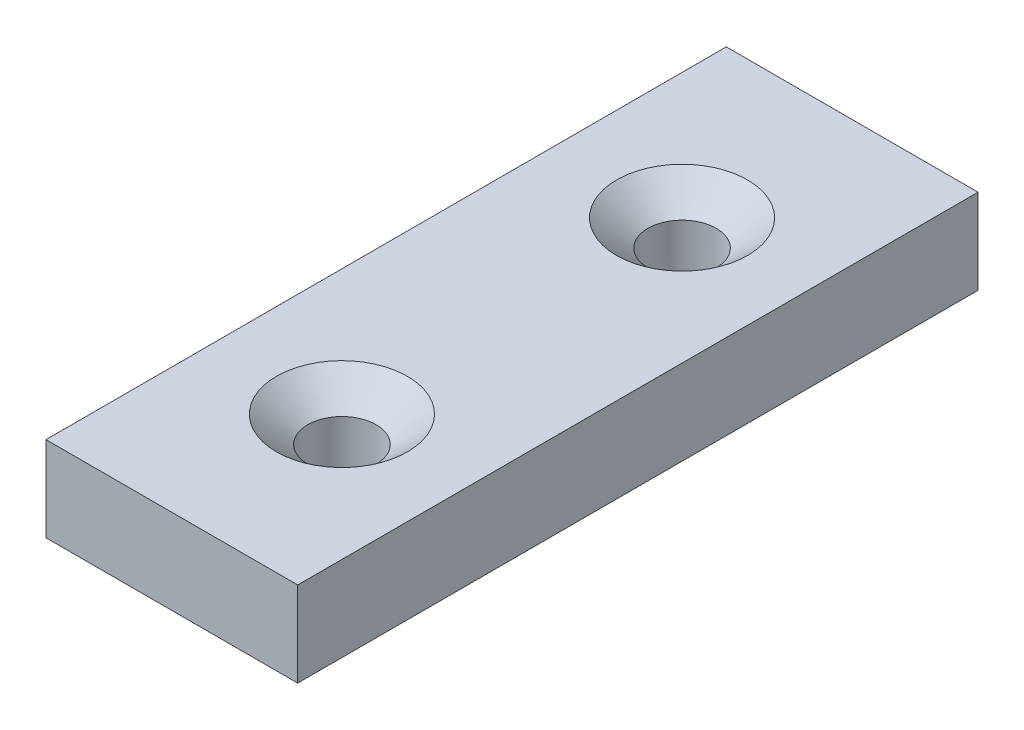
from build123d import *

# Parameters (mm, degrees)
SKETCH1_W                                          = 18.796
SKETCH1_H                                          = 50.8
BOSS_EXTRUDE1_DEPTH                                = 6.35
CSK_FOR_10_FLAT_HEAD_MACHINE_SCREW_100_D           = 5.1054
CSK_FOR_10_FLAT_HEAD_MACHINE_SCREW_100_DEPTH       = 25.4
CSK_FOR_10_FLAT_HEAD_MACHINE_SCREW_100_CSINK_D     = 9.779
CSK_FOR_10_FLAT_HEAD_MACHINE_SCREW_100_CSINK_ANGLE = 100
CSK_FOR_10_FLAT_HEAD_MACHINE_SCREW_100_TIP         = 1.533816902


with BuildPart() as part:
    # Sketch1 → Boss-Extrude1 (new body)
    with BuildSketch(Plane(origin=(0, 0, 0), x_dir=(1, 0, 0), z_dir=(0, 1, 0))):
        with Locations((9.398, 25.4)):
            Rectangle(SKETCH1_W, SKETCH1_H)
    extrude(amount=BOSS_EXTRUDE1_DEPTH)

    # CSK for #10 Flat Head Machine Screw (100)1
    with Locations(Plane(origin=(0, 6.35, 0), x_dir=(1, 0, 0), z_dir=(0, 1, 0))):
        with Locations((9.398, 38.1), (9.398, 12.7)):
            CounterSinkHole(CSK_FOR_10_FLAT_HEAD_MACHINE_SCREW_100_D / 2, CSK_FOR_10_FLAT_HEAD_MACHINE_SCREW_100_CSINK_D / 2, depth=CSK_FOR_10_FLAT_HEAD_MACHINE_SCREW_100_DEPTH, counter_sink_angle=CSK_FOR_10_FLAT_HEAD_MACHINE_SCREW_100_CSINK_ANGLE)
            with Locations((0, 0, -(CSK_FOR_10_FLAT_HEAD_MACHINE_SCREW_100_DEPTH + CSK_FOR_10_FLAT_HEAD_MACHINE_SCREW_100_TIP / 2))):  # 118° drill point
                Cone(0, CSK_FOR_10_FLAT_HEAD_MACHINE_SCREW_100_D / 2, CSK_FOR_10_FLAT_HEAD_MACHINE_SCREW_100_TIP, mode=Mode.SUBTRACT)


solid = part.part
